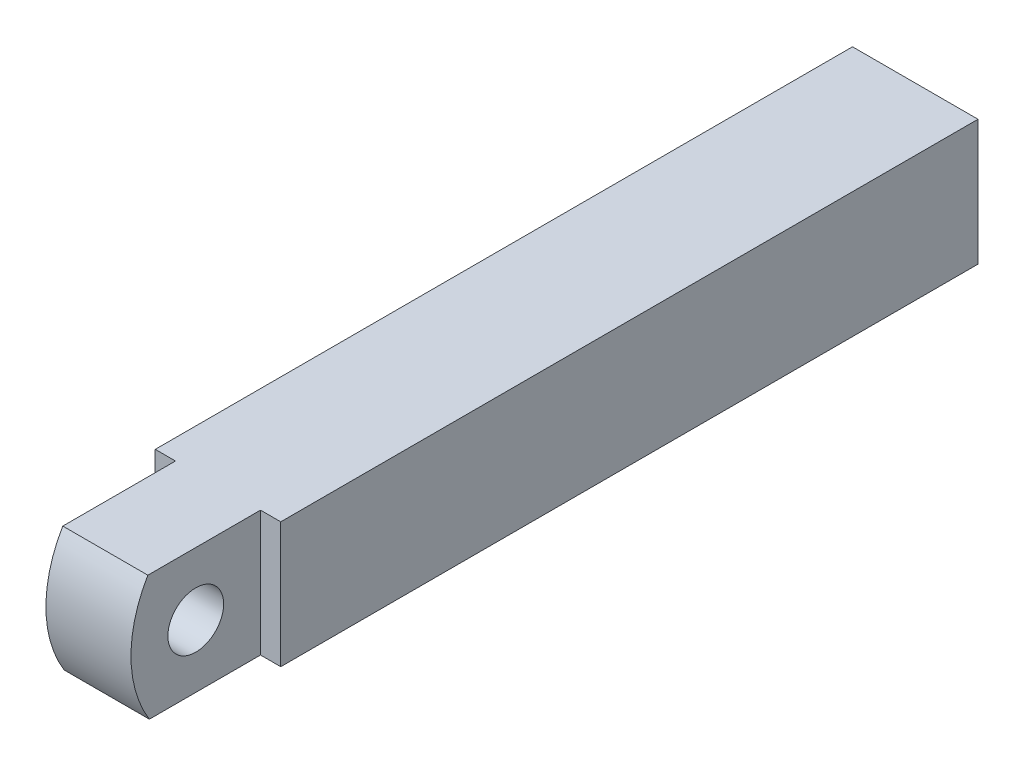
from build123d import *

# Parameters (mm, degrees)
ESQUISSE1_W        = 9
ESQUISSE1_H        = 9
BOSS_EXTRU_1_DEPTH = 50
BOSS_EXTRU_3_START = -1.45
ESQUISSE2_R        = 2
BOSS_EXTRU_3_DEPTH = 6.1


with BuildPart() as part:
    # Esquisse1 → Boss.-Extru.1 (new body)
    with BuildSketch(Plane.XY):
        Rectangle(ESQUISSE1_W, ESQUISSE1_H)
    extrude(amount=BOSS_EXTRU_1_DEPTH)

    # Esquisse2 → Boss.-Extru.3 (add)
    with BuildSketch(Plane(origin=(4.5, 0, 0), x_dir=(0, 0, -1), z_dir=(1, 0, 0)).offset(BOSS_EXTRU_3_START)):
        with BuildLine():
            Line((-50, 4.5), (-58.080541819, 4.5))
            ThreePointArc((-58.080541819, 4.5), (-58.982154324, 2.376383494), (-59.29, 0.089927018))
            ThreePointArc((-59.29, 0.089927018), (-58.953679263, -2.297932577), (-57.970885209, -4.5))
            Line((-57.970885209, -4.5), (-50, -4.5))
            Line((-50, -4.5), (-50, 4.5))
        make_face()
        with Locations(Location((-54.645, 0, 0), (0, 0, 90))):
            Circle(ESQUISSE2_R, mode=Mode.SUBTRACT)
    extrude(amount=-BOSS_EXTRU_3_DEPTH)


solid = part.part
